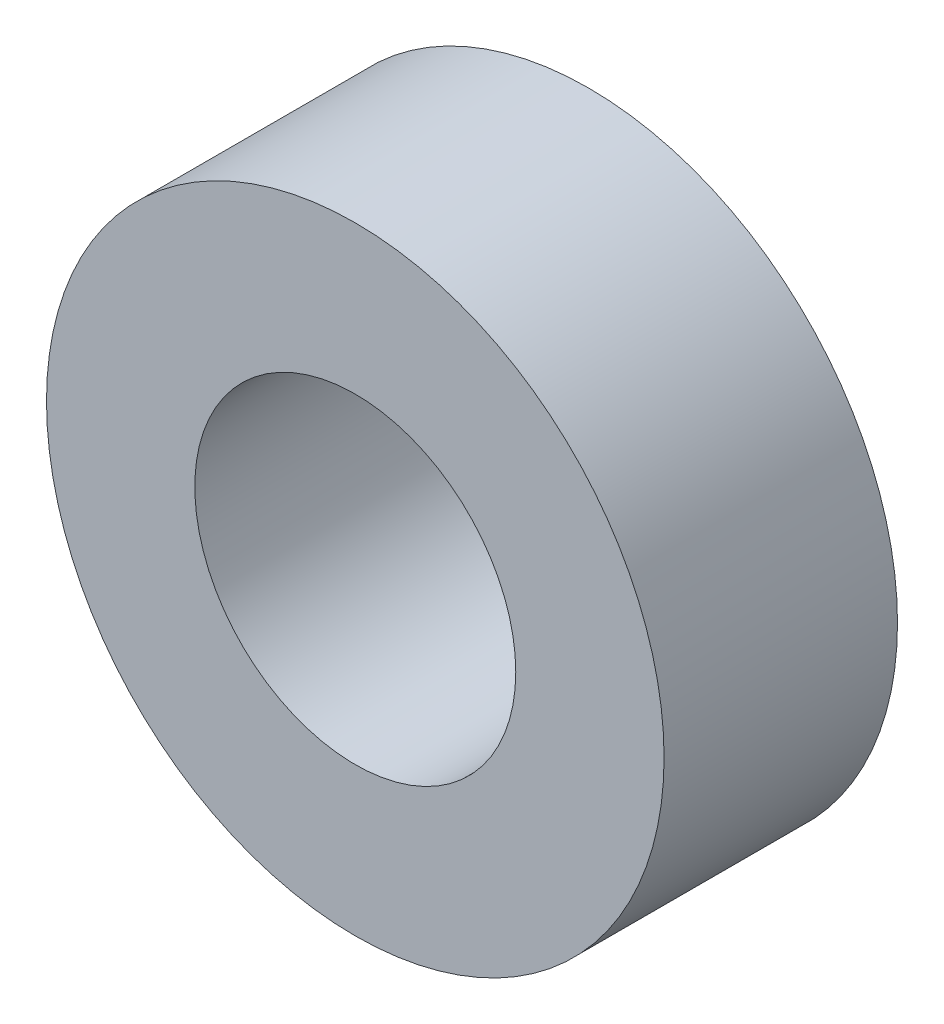
from build123d import *

# Parameters (mm, degrees)
SKETCH_1_R            = 3.175
EXTRUDE_246_DEPTH     = 2.4
SKETCH_2_R            = 1.65
CUT_EXTRUDE_315_DEPTH = 2.4


with BuildPart() as part:
    # 草图1 → Extrude 246 (new body)
    with BuildSketch(Plane.XY):
        Circle(SKETCH_1_R)
    extrude(amount=EXTRUDE_246_DEPTH)

    # 草图2 → Cut-Extrude 315 (cut)
    with BuildSketch(Plane.XY):
        Circle(SKETCH_2_R)
    extrude(amount=CUT_EXTRUDE_315_DEPTH, mode=Mode.SUBTRACT)


solid = part.part
